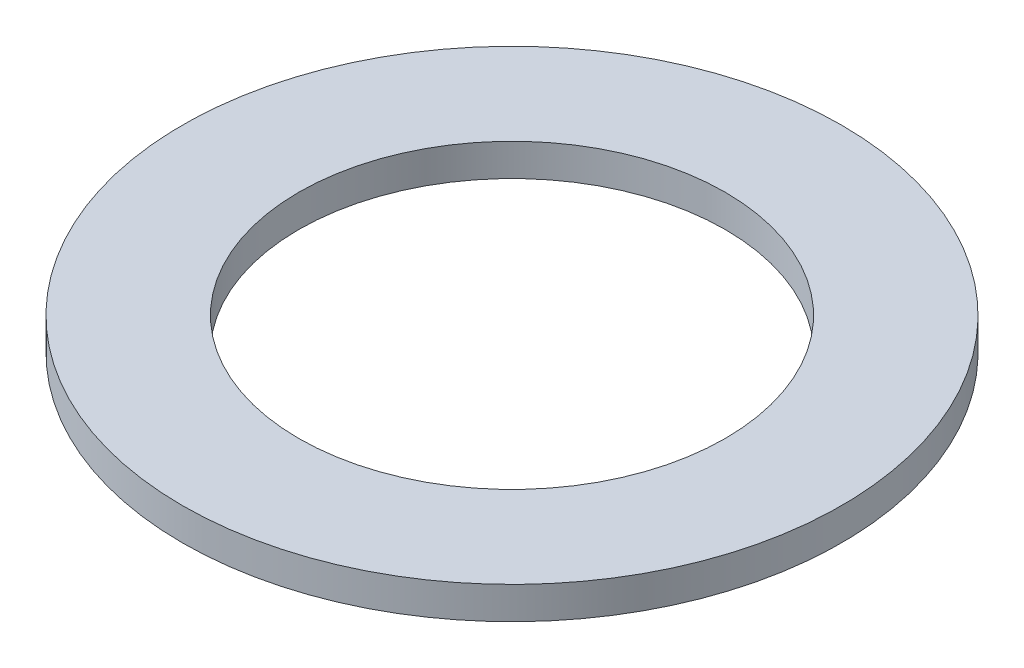
from build123d import *

# Parameters (mm, degrees)
SKETCH1_W = 1.8
SKETCH1_H = 0.5


with BuildPart() as part:
    # Sketch1 → Revolve1 (revolve)
    with BuildSketch(Plane.XY, mode=Mode.PRIVATE) as revolve1_sk:
        with Locations((4.2, 2.25)):
            Rectangle(SKETCH1_W, SKETCH1_H)
    revolve(revolve1_sk.sketch.rotate(Axis((0, -200, 0), (0, 1, 0)), 90), axis=Axis((0, -200, 0), (0, 1, 0)))


solid = part.part
